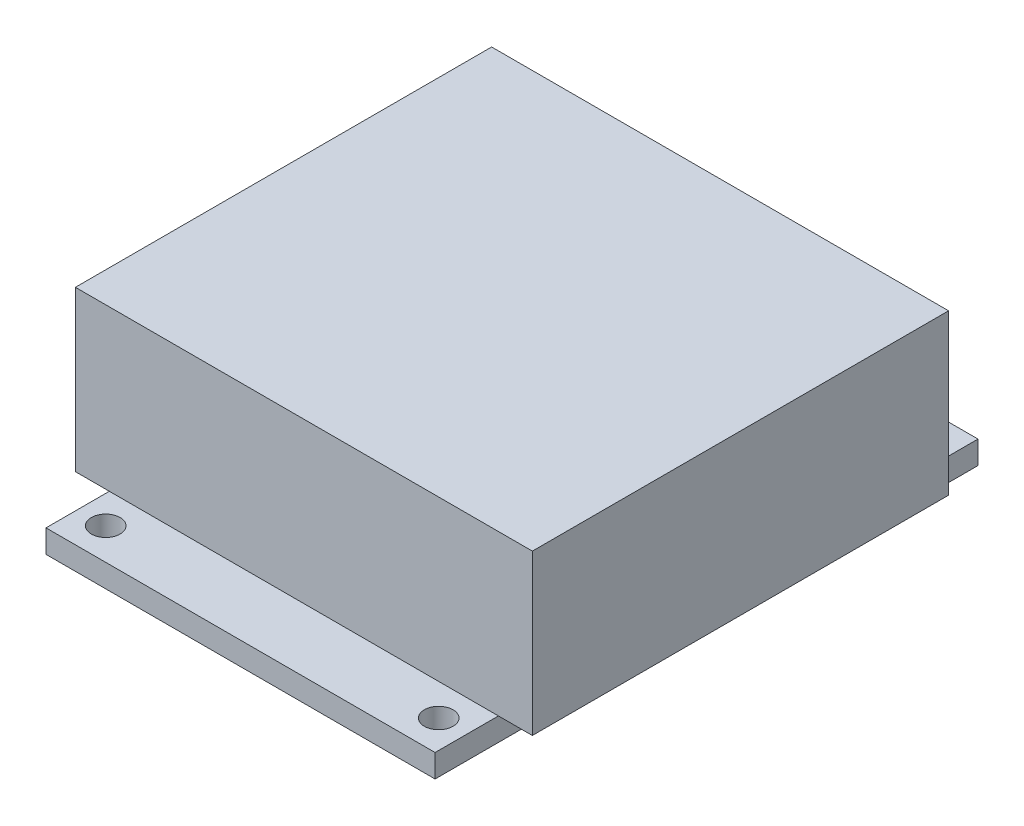
from build123d import *

# Parameters (mm, degrees)
SKETCH1_W           = 43
SKETCH1_H           = 60
SKETCH1_R           = 1.5875
BOSS_EXTRUDE1_DEPTH = 2.54
SKETCH2_W           = 50.5
SKETCH2_H           = 46
BOSS_EXTRUDE2_DEPTH = 17.65


with BuildPart() as part:
    # Sketch1 → Boss-Extrude1 (new body)
    with BuildSketch(Plane(origin=(0, 0, 0), x_dir=(1, 0, 0), z_dir=(0, 1, 0))):
        Rectangle(SKETCH1_W, SKETCH1_H)
        with Locations(Location((-18.4, 26.5, 0), (0, 0, 270))):
            Circle(SKETCH1_R, mode=Mode.SUBTRACT)
        with Locations(Location((18.4, 26.5, 0), (0, 0, 270))):
            Circle(SKETCH1_R, mode=Mode.SUBTRACT)
        with Locations(Location((18.4, -26.5, 0), (0, 0, 270))):
            Circle(SKETCH1_R, mode=Mode.SUBTRACT)
        with Locations(Location((-18.4, -26.5, 0), (0, 0, 270))):
            Circle(SKETCH1_R, mode=Mode.SUBTRACT)
    extrude(amount=BOSS_EXTRUDE1_DEPTH)

    # Sketch2 → Boss-Extrude2 (add)
    with BuildSketch(Plane(origin=(0, 2.54, 0), x_dir=(1, 0, 0), z_dir=(0, 1, 0))):
        Rectangle(SKETCH2_W, SKETCH2_H)
    extrude(amount=BOSS_EXTRUDE2_DEPTH)


solid = part.part
